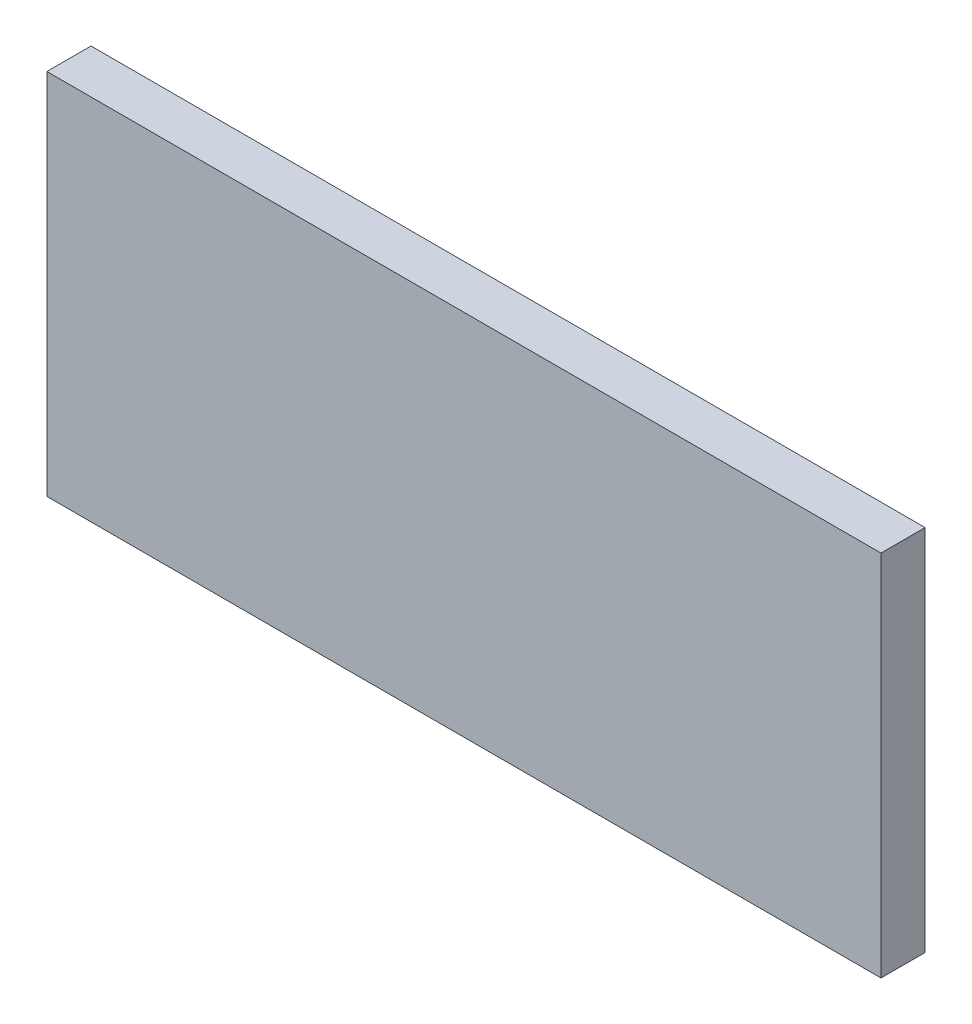
from build123d import *

# Parameters (mm, degrees)
SKETCH1_W           = 340
SKETCH1_H           = 150
BOSS_EXTRUDE1_DEPTH = 18


with BuildPart() as part:
    # Sketch1 → Boss-Extrude1 (new body)
    with BuildSketch(Plane.XY):
        with Locations((170, 75)):
            Rectangle(SKETCH1_W, SKETCH1_H)
    extrude(amount=BOSS_EXTRUDE1_DEPTH)


solid = part.part
